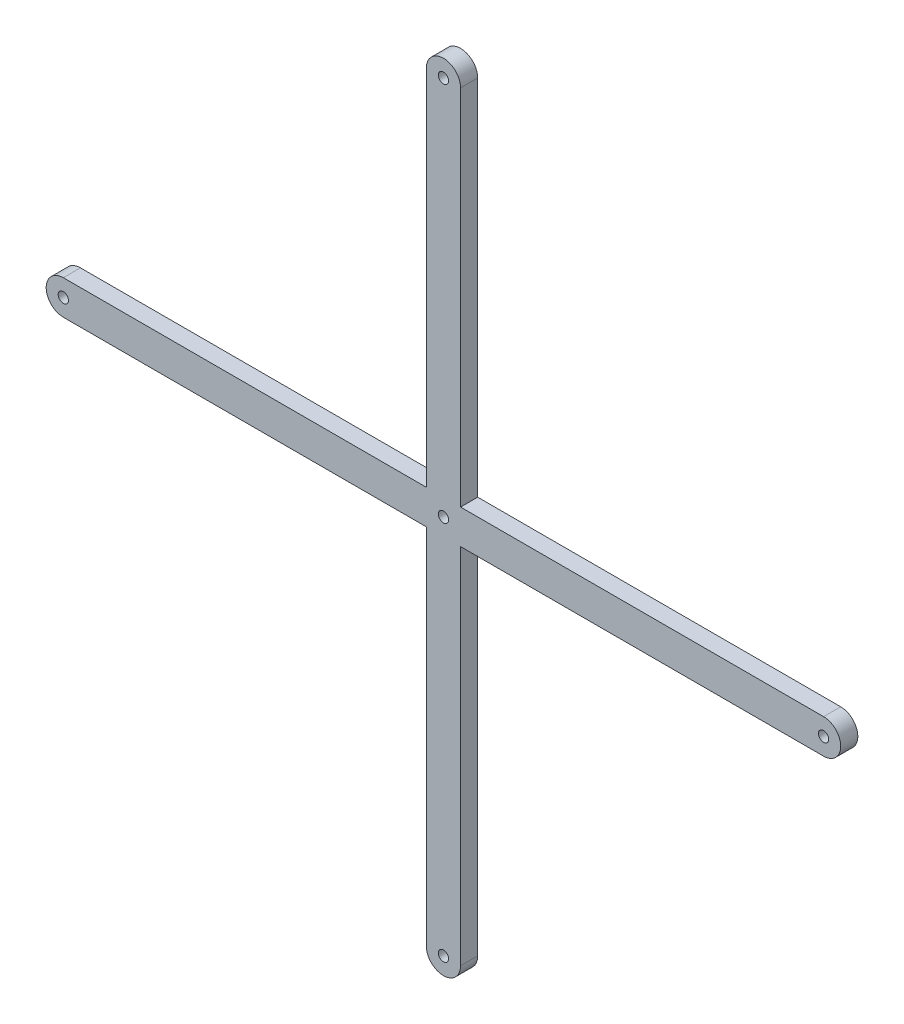
from build123d import *

# Parameters (mm, degrees)
SKETCH1_R           = 1.5
BOSS_EXTRUDE1_DEPTH = 5


with BuildPart() as part:
    # Sketch1 → Boss-Extrude1 (new body)
    with BuildSketch(Plane.XY):
        with BuildLine():
            Line((5, -5), (5, -111))
            ThreePointArc((5, -111), (0, -116), (-5, -111))
            Line((-5, -111), (-5, -5))
            Line((-5, -5), (-111, -5))
            ThreePointArc((-111, -5), (-116, 0), (-111, 5))
            Line((-111, 5), (-5, 5))
            Line((-5, 5), (-5, 111))
            ThreePointArc((-5, 111), (0, 116), (5, 111))
            Line((5, 111), (5, 5))
            Line((5, 5), (111, 5))
            ThreePointArc((111, 5), (116, 0), (111, -5))
            Line((111, -5), (5, -5))
        make_face()
        Circle(SKETCH1_R, mode=Mode.SUBTRACT)
        with Locations((0, -111)):
            Circle(SKETCH1_R, mode=Mode.SUBTRACT)
        with Locations((-111, 0)):
            Circle(SKETCH1_R, mode=Mode.SUBTRACT)
        with Locations((0, 111)):
            Circle(SKETCH1_R, mode=Mode.SUBTRACT)
        with Locations((111, 0)):
            Circle(SKETCH1_R, mode=Mode.SUBTRACT)
    extrude(amount=BOSS_EXTRUDE1_DEPTH)


solid = part.part
